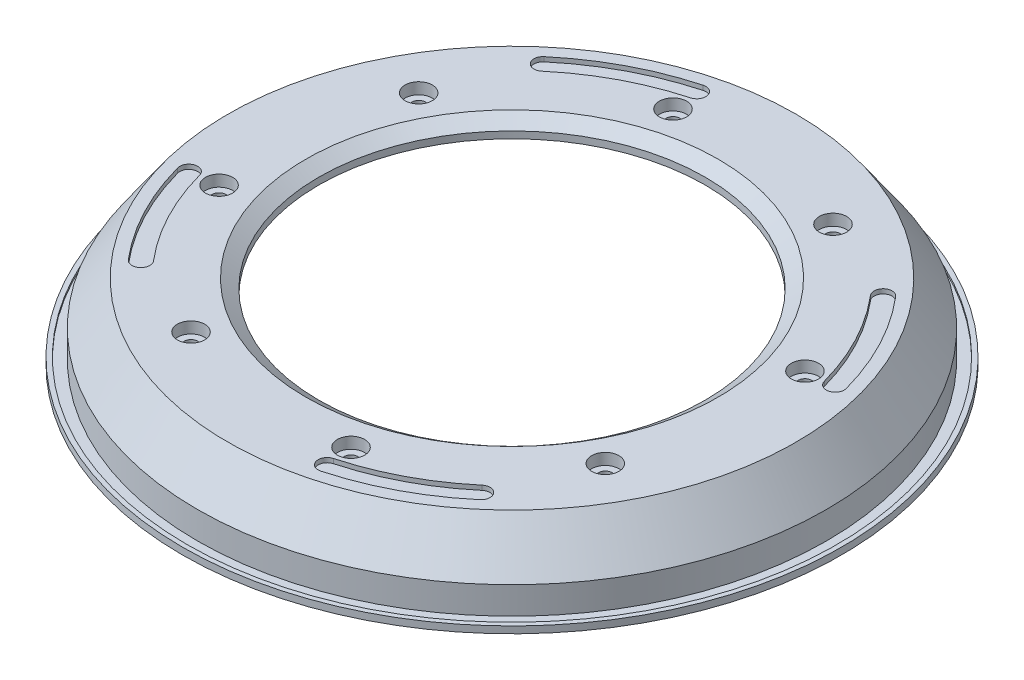
from build123d import *

# Parameters (mm, degrees)
SKETCH_1_R               = 72.5
SKETCH_1_R_2             = 65
EXTRUDE_1_DEPTH          = 1
SKETCH_2_W               = 1
SKETCH_2_H               = 0.5
SKETCH_3_R               = 67.173254354
CUT_EXTRUDE_1_DEPTH      = 500
EXTRUDE_START            = 6
SKETCH_4_R               = 69.173254354
SKETCH_4_R_2             = 67.173254354
EXTRUDE_2_DEPTH          = 6
SKETCH_9_R               = 3
CUT_EXTRUDE_3_DEPTH      = 50
PATTERN_CIRCULAR_1_COUNT = 8
EXTRUDE_4_REACH          = 105.351
SKETCH_10_R              = 64.083899557
SKETCH_10_R_2            = 42.5
SKETCH_11_R              = 3
CUT_EXTRUDE_4_DEPTH      = 50
PATTERN_CIRCULAR_2_COUNT = 8
EXTRUDE_START_2          = -1
SKETCH_13_R              = 3
SKETCH_13_R_2            = 1.5
EXTRUDE_5_DEPTH          = 1
PATTERN_CIRCULAR_3_COUNT = 8
CUT_EXTRUDE_5_DEPTH      = 1
PATTERN_CIRCULAR_4_COUNT = 4


with BuildPart() as part:
    # 草图1 → 凸台-拉伸1 (new body)
    with BuildSketch(Plane(origin=(0, 0, 0), x_dir=(1, 0, 0), z_dir=(0, 1, 0))):
        with Locations(Location((0, 0, 0), (0, 0, 270))):
            Circle(SKETCH_1_R)
        with Locations(Location((0, 0, 0), (0, 0, 270))):
            Circle(SKETCH_1_R_2, mode=Mode.SUBTRACT)
    extrude(amount=EXTRUDE_1_DEPTH)

    # 草图2 → 旋转1 (revolve)
    with BuildSketch(Plane.XY, mode=Mode.PRIVATE) as revolve_1_sk:
        with Locations((-72, 1.25)):
            Rectangle(SKETCH_2_W, SKETCH_2_H)
    revolve(revolve_1_sk.sketch.rotate(Axis((0, 15.807831018, 0), (0, -1, 0)), 270), axis=Axis((0, 15.807831018, 0), (0, -1, 0)))

    # 草图3 → 切除-拉伸1 (cut)
    with BuildSketch(Plane(origin=(0, 1, 0), x_dir=(1, 0, 0), z_dir=(0, 1, 0))):
        with Locations(Location((0, 0, 0), (0, 0, 270))):
            Circle(SKETCH_3_R)
    extrude(amount=-CUT_EXTRUDE_1_DEPTH, mode=Mode.SUBTRACT)

    # 草图4 → 凸台-拉伸2 (add)
    with BuildSketch(Plane(origin=(0, 1, 0), x_dir=(1, 0, 0), z_dir=(0, 1, 0)).offset(EXTRUDE_START)):
        with Locations(Location((0, 0, 0), (0, 0, 270))):
            Circle(SKETCH_4_R)
        with Locations(Location((0, 0, 0), (0, 0, 270))):
            Circle(SKETCH_4_R_2, mode=Mode.SUBTRACT)
    extrude(amount=-EXTRUDE_2_DEPTH)

    # 草图5 → 旋转3 (revolve)
    with BuildSketch(Plane.XY, mode=Mode.PRIVATE) as revolve_3_sk:
        Polygon((-69.173254354, 7), (-62.5, 16.5), (-45.358003893, 16.5), (-42.5, 14.5), (-61.460773767, 14.5), (-66.729132467, 7), align=None)
    revolve(revolve_3_sk.sketch.rotate(Axis((0, 1.5, 0), (0, 1, 0)), 270), axis=Axis((0, 1.5, 0), (0, 1, 0)))

    # 草图9 → 切除-拉伸3 (cut)
    with BuildSketch(Plane(origin=(0, 16.5, 0), x_dir=(1, 0, 0), z_dir=(0, 1, 0))):
        with Locations(Location((25.043627949, 45.572104397, 0), (0, 0, 270))):
            Circle(SKETCH_9_R)
    cut_extrude_3 = extrude(amount=-CUT_EXTRUDE_3_DEPTH, mode=Mode.SUBTRACT)

    # 阵列(圆周)1: 切除-拉伸3 ×8 about axis
    pattern_circular_1_axis = Axis((0, 0, 0), (0, 1, 0))
    for i in range(1, PATTERN_CIRCULAR_1_COUNT):
        add(cut_extrude_3.rotate(pattern_circular_1_axis, i * 360 / PATTERN_CIRCULAR_1_COUNT), mode=Mode.SUBTRACT)

    # 凸台-拉伸4: up to this face of the body (flat: up to its plane)
    extrude_4_end = Plane(part.part.faces().sort_by_distance((0, 14.5, 59.72240057))[0])
    # 草图10 → 凸台-拉伸4 (add, up to the picked face)
    with BuildSketch(Plane.XZ.offset(-13), mode=Mode.PRIVATE) as extrude_4_sk1:
        with Locations(Location((0, 0, 0), (0, 0, 270))):
            Circle(SKETCH_10_R)
        with Locations(Location((0, 0, 0), (0, 0, 270))):
            Circle(SKETCH_10_R_2, mode=Mode.SUBTRACT)
    extrude_4_tool1 = split(extrude(extrude_4_sk1.sketch, amount=-EXTRUDE_4_REACH, mode=Mode.PRIVATE), bisect_by=extrude_4_end, keep=Keep.BOTH, mode=Mode.PRIVATE)
    add(extrude_4_tool1.solids().sort_by(Axis((0, 13, 62.271333), (0, 1, 0)))[0])

    # 草图11 → 切除-拉伸4 (cut)
    with BuildSketch(Plane(origin=(0, 16.5, 0), x_dir=(1, 0, 0), z_dir=(0, 1, 0))):
        with Locations(Location((14.515824903, -49.9328632, 0), (0, 0, 135))):
            Circle(SKETCH_11_R)
    cut_extrude_4 = extrude(amount=-CUT_EXTRUDE_4_DEPTH, mode=Mode.SUBTRACT)

    # 阵列(圆周)2: 切除-拉伸4 ×8 about axis
    pattern_circular_2_axis = Axis((0, 0, 0), (0, 1, 0))
    for i in range(1, PATTERN_CIRCULAR_2_COUNT):
        add(cut_extrude_4.rotate(pattern_circular_2_axis, i * 360 / PATTERN_CIRCULAR_2_COUNT), mode=Mode.SUBTRACT)

    # 草图12 → 切除-旋转1 (revolve, cut)
    with BuildSketch(Plane.XY, mode=Mode.PRIVATE) as cut_revolve_1_sk:
        Polygon((-69.173254354, 7), (-62.5, 16.5), (-70.752238468, 16.5), align=None)
    revolve(cut_revolve_1_sk.sketch.rotate(Axis((0, 0, 0), (0, 1, 0)), 270), axis=Axis((0, 0, 0), (0, 1, 0)), mode=Mode.SUBTRACT)

    # 草图13 → 凸台-拉伸5 (add)
    with BuildSketch(Plane.XZ.offset(-13).offset(EXTRUDE_START_2)):
        with Locations(Location((49.9328632, -14.515824903, 0), (0, 0, 135))):
            Circle(SKETCH_13_R)
        with Locations(Location((49.9328632, -14.515824903, 0), (0, 0, 270))):
            Circle(SKETCH_13_R_2, mode=Mode.SUBTRACT)
    extrude_5 = extrude(amount=EXTRUDE_5_DEPTH)

    # 阵列(圆周)3: 凸台-拉伸5 ×8 about axis
    pattern_circular_3_axis = Axis((0, 0, 0), (0, 1, 0))
    for i in range(1, PATTERN_CIRCULAR_3_COUNT):
        add(extrude_5.rotate(pattern_circular_3_axis, i * 360 / PATTERN_CIRCULAR_3_COUNT))

    # 草图14 → 切除-拉伸5 (cut)
    with BuildSketch(Plane(origin=(0, 16.5, 0), x_dir=(1, 0, 0), z_dir=(0, 1, 0))):
        with BuildLine():
            ThreePointArc((-15.741399661, 57.790873535), (-27.876499993, 53.013936615), (-38.69003161, 45.723715743))
            ThreePointArc((-38.69003161, 45.723715743), (-38.921101796, 42.950560173), (-36.147946226, 42.719489986))
            ThreePointArc((-36.147946226, 42.719489986), (-26.044905646, 49.530715026), (-14.707128549, 53.993788632))
            ThreePointArc((-14.707128549, 53.993788632), (-13.325721654, 56.40946664), (-15.741399661, 57.790873535))
        make_face()
    cut_extrude_5 = extrude(amount=-CUT_EXTRUDE_5_DEPTH, mode=Mode.SUBTRACT)

    # 阵列(圆周)4: 切除-拉伸5 ×4 about axis
    pattern_circular_4_axis = Axis((0, 0, 0), (0, 1, 0))
    for i in range(1, PATTERN_CIRCULAR_4_COUNT):
        add(cut_extrude_5.rotate(pattern_circular_4_axis, i * 360 / PATTERN_CIRCULAR_4_COUNT), mode=Mode.SUBTRACT)


solid = part.part
